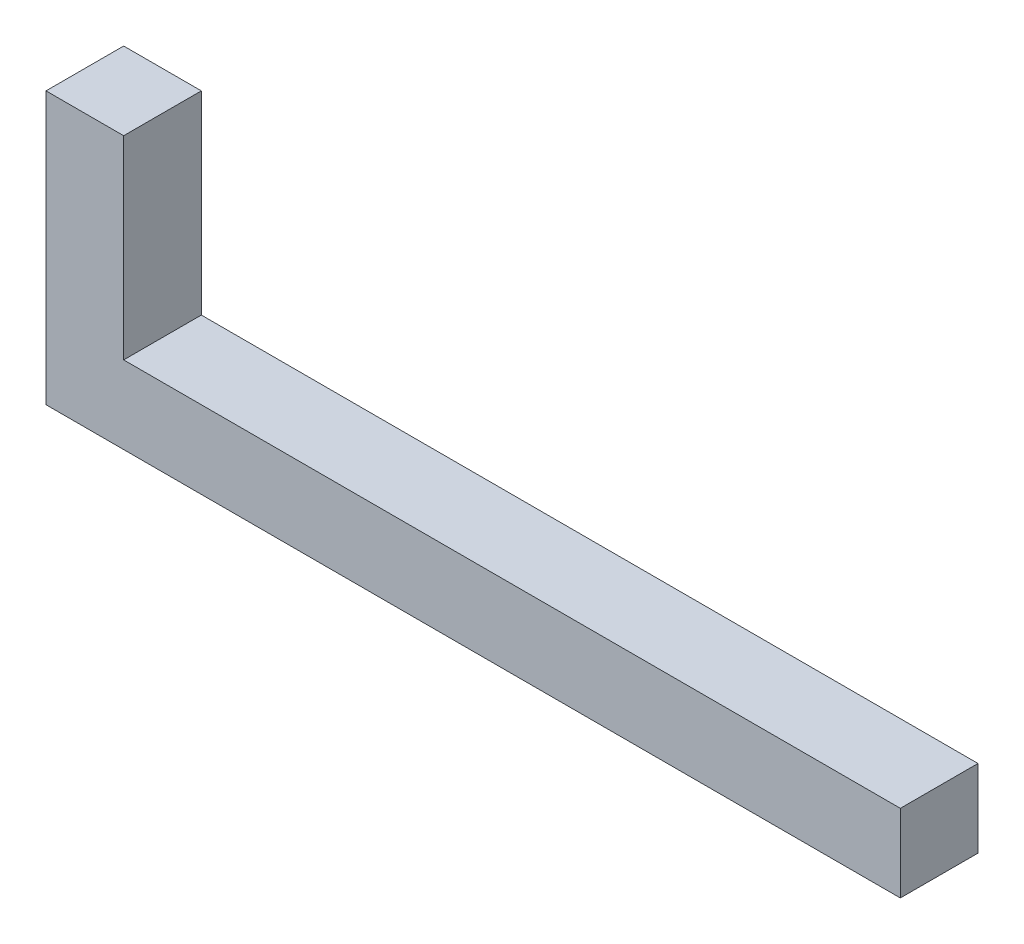
from build123d import *

# Parameters (mm, degrees)
BOSS_EXTRUDE1_DEPTH = 10


with BuildPart() as part:
    # Sketch1 → Boss-Extrude1 (new body)
    with BuildSketch(Plane.XY):
        Polygon((0, 0), (-100, 0), (-100, 25), (-110, 25), (-110, -10), (0, -10), align=None)
    extrude(amount=BOSS_EXTRUDE1_DEPTH)


solid = part.part
